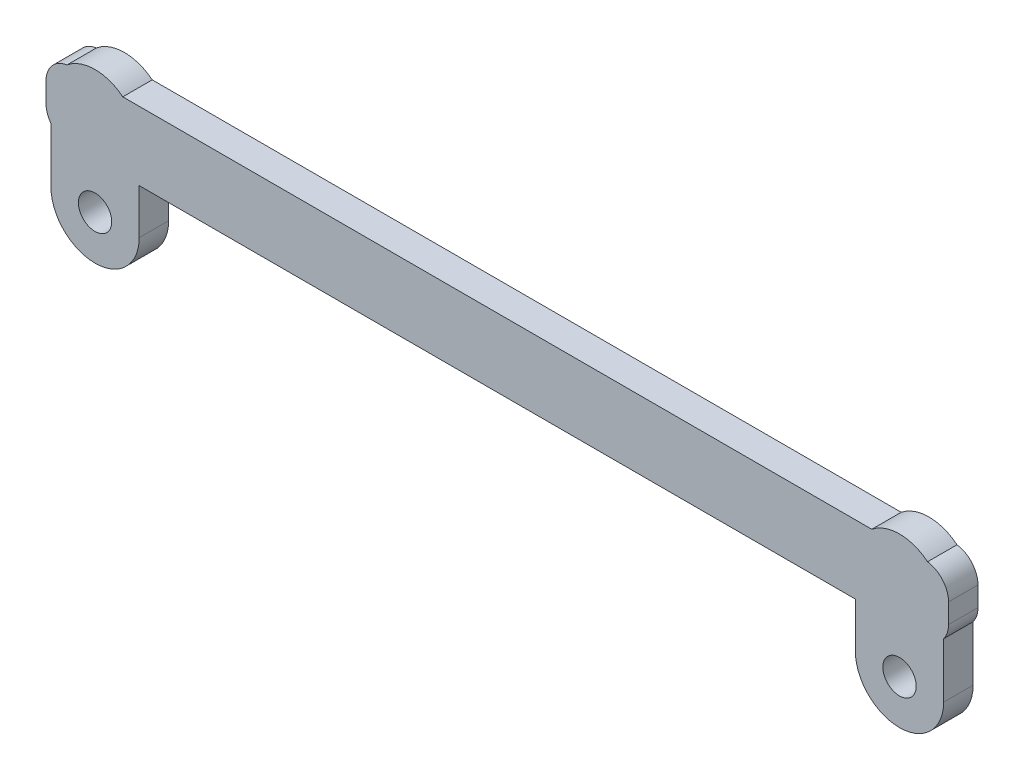
from build123d import *

# Parameters (mm, degrees)
F_01_REMOVABLE_UPPER_CROSSBAR_DEPTH = 3
S02_FASTENING_LUG_0_R               = 1.7
F_02_FASTENING_LUG_0_DEPTH          = 3
S03_FASTENING_LUG_1_R               = 1.7
F_03_FASTENING_LUG_1_DEPTH          = 3


with BuildPart() as part:
    # S01 - Removable upper crossbar → 01 - Removable upper crossbar (new body)
    with BuildSketch(Plane.XY):
        with BuildLine():
            Line((-43.5, -53.7), (43.5, -53.7))
            ThreePointArc((43.5, -53.7), (45.267766953, -52.967766953), (46, -51.2))
            Line((46, -51.2), (46, -49.2))
            ThreePointArc((46, -49.2), (45.267766953, -47.432233047), (43.5, -46.7))
            Line((43.5, -46.7), (-43.5, -46.7))
            ThreePointArc((-43.5, -46.7), (-45.267766953, -47.432233047), (-46, -49.2))
            Line((-46, -49.2), (-46, -51.2))
            ThreePointArc((-46, -51.2), (-45.267766953, -52.967766953), (-43.5, -53.7))
        make_face()
    extrude(amount=F_01_REMOVABLE_UPPER_CROSSBAR_DEPTH)

    # S02 - Fastening lug 0 → 02 - Fastening lug 0 (add)
    with BuildSketch(Plane.XY):
        with BuildLine():
            Line((-45.5, -58.3), (-45.5, -50.2))
            ThreePointArc((-45.5, -50.2), (-41, -45.7), (-36.5, -50.2))
            Line((-36.5, -50.2), (-36.5, -58.3))
            ThreePointArc((-36.5, -58.3), (-41, -62.8), (-45.5, -58.3))
        make_face()
        with Locations((-41, -58.3)):
            Circle(S02_FASTENING_LUG_0_R, mode=Mode.SUBTRACT)
    extrude(amount=F_02_FASTENING_LUG_0_DEPTH)

    # S03 - Fastening lug 1 → 03 - Fastening lug 1 (add)
    with BuildSketch(Plane.XY):
        with BuildLine():
            Line((36.5, -58.3), (36.5, -50.2))
            ThreePointArc((36.5, -50.2), (41, -45.7), (45.5, -50.2))
            Line((45.5, -50.2), (45.5, -58.3))
            ThreePointArc((45.5, -58.3), (41, -62.8), (36.5, -58.3))
        make_face()
        with Locations((41, -58.3)):
            Circle(S03_FASTENING_LUG_1_R, mode=Mode.SUBTRACT)
    extrude(amount=F_03_FASTENING_LUG_1_DEPTH)


solid = part.part
